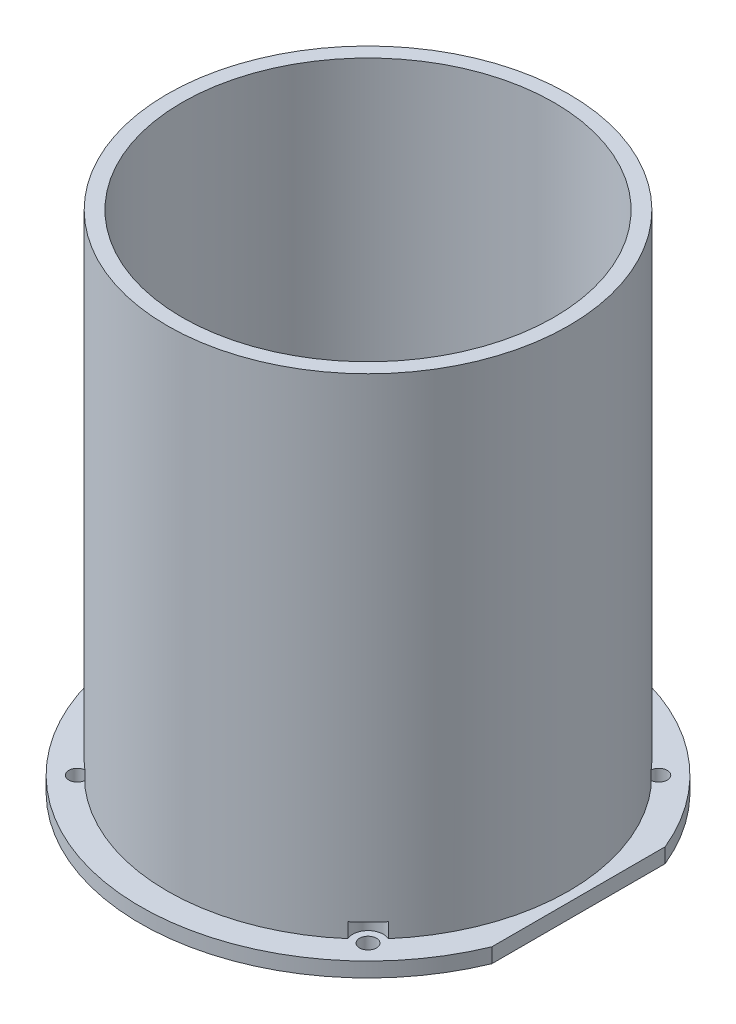
from build123d import *

# Parameters (mm, degrees)
SKETCH1_R                      = 46.5
SKETCH1_R_2                    = 38
BOSS_EXTRUDE1_DEPTH            = 3
SKETCH2_R                      = 41
SKETCH2_R_2                    = 38
BOSS_EXTRUDE2_DEPTH            = 100
SKETCH4_W                      = 1.7272
SKETCH4_H                      = 3
F_4_CLEARANCE_HOLE1_AT_2_COUNT = 2
F_4_CLEARANCE_HOLE1_AT_2_PITCH = 59.39696962
F_4_CLEARANCE_HOLE1_AT_3_COUNT = 2
F_4_CLEARANCE_HOLE1_AT_3_PITCH = 84
F_4_CLEARANCE_HOLE1_AT_4_COUNT = 2
F_4_CLEARANCE_HOLE1_AT_4_PITCH = 59.39696962
SKETCH5_R                      = 3.125
CUT_EXTRUDE1_DEPTH             = 3
BOSS_EXTRUDE3_START            = -2
BOSS_EXTRUDE3_DEPTH            = 7
CIRPATTERN3_COUNT              = 4
CUT_EXTRUDE2_DEPTH             = 120.685003238


with BuildPart() as part:
    # Sketch1 → Boss-Extrude1 (new body)
    with BuildSketch(Plane(origin=(0, 0, 0), x_dir=(1, 0, 0), z_dir=(0, 1, 0))):
        with Locations(Location((0, 0, 0), (0, 0, 270))):
            Circle(SKETCH1_R)
        with Locations(Location((0, 0, 0), (0, 0, 270))):
            Circle(SKETCH1_R_2, mode=Mode.SUBTRACT)
    extrude(amount=BOSS_EXTRUDE1_DEPTH)

    # Sketch2 → Boss-Extrude2 (add)
    with BuildSketch(Plane(origin=(0, 3, 0), x_dir=(1, 0, 0), z_dir=(0, 1, 0))):
        with Locations(Location((0, 0, 0), (0, 0, 270))):
            Circle(SKETCH2_R)
        with Locations(Location((0, 0, 0), (0, 0, 270))):
            Circle(SKETCH2_R_2, mode=Mode.SUBTRACT)
    extrude(amount=BOSS_EXTRUDE2_DEPTH)

    # Sketch4 → #4 Clearance Hole1 (revolve, cut)
    with BuildSketch(Plane(origin=(-29.69848481, 3, -29.69848481), x_dir=(0, 0, 1), z_dir=(1, 0, 0))):
        with Locations((0.8636, 1.5)):
            Rectangle(SKETCH4_W, SKETCH4_H)
    f_4_clearance_hole1 = revolve(axis=Axis((-29.69848481, 9.35, -29.69848481), (0, -1, 0)), mode=Mode.SUBTRACT)

    # #4 Clearance Hole1 at 2: #4 Clearance Hole1 ×2
    with Locations(*[(i * F_4_CLEARANCE_HOLE1_AT_2_PITCH, 0, 0) for i in range(1, F_4_CLEARANCE_HOLE1_AT_2_COUNT)]):
        add(f_4_clearance_hole1, mode=Mode.SUBTRACT)

    # #4 Clearance Hole1 at 3: #4 Clearance Hole1 ×2
    with Locations(*[Vector(0.7071067811865476, 0, 0.7071067811865476) * (i * F_4_CLEARANCE_HOLE1_AT_3_PITCH) for i in range(1, F_4_CLEARANCE_HOLE1_AT_3_COUNT)]):
        add(f_4_clearance_hole1, mode=Mode.SUBTRACT)

    # #4 Clearance Hole1 at 4: #4 Clearance Hole1 ×2
    with Locations(*[(0, 0, i * F_4_CLEARANCE_HOLE1_AT_4_PITCH) for i in range(1, F_4_CLEARANCE_HOLE1_AT_4_COUNT)]):
        add(f_4_clearance_hole1, mode=Mode.SUBTRACT)

    # Sketch5 → Cut-Extrude1 (cut)
    with BuildSketch(Plane(origin=(0, 3, 0), x_dir=(1, 0, 0), z_dir=(0, 1, 0))):
        with Locations((-29.69848481, 29.69848481)):
            Circle(SKETCH5_R)
    cut_extrude1 = extrude(amount=CUT_EXTRUDE1_DEPTH, mode=Mode.SUBTRACT)

    # Sketch6 → Boss-Extrude3 (add)
    with BuildSketch(Plane(origin=(0, 3, 0), x_dir=(1, 0, 0), z_dir=(0, 1, 0)).offset(BOSS_EXTRUDE3_START)):
        with BuildLine():
            ThreePointArc((-31.890308819, 25.76835663), (-26.516504294, 26.516504294), (-25.76835663, 31.890308819))
            ThreePointArc((-25.76835663, 31.890308819), (-26.313305576, 31.442168336), (-26.850462289, 30.984716795))
            ThreePointArc((-26.850462289, 30.984716795), (-27.488776119, 27.488776119), (-30.984716795, 26.850462289))
            ThreePointArc((-30.984716795, 26.850462289), (-31.442168336, 26.313305576), (-31.890308819, 25.76835663))
        make_face()
    boss_extrude3 = extrude(amount=BOSS_EXTRUDE3_DEPTH)

    # CirPattern3: Cut-Extrude1, Boss-Extrude3 ×4 about axis
    cirpattern3_axis = Axis((0, 0, 0), (0, 1, 0))
    add([cut_extrude1.rotate(cirpattern3_axis, i * 360 / CIRPATTERN3_COUNT) for i in range(1, CIRPATTERN3_COUNT)], mode=Mode.SUBTRACT)
    add([boss_extrude3.rotate(cirpattern3_axis, i * 360 / CIRPATTERN3_COUNT) for i in range(1, CIRPATTERN3_COUNT)])

    # Sketch7 → Cut-Extrude2 (cut, through all)
    with BuildSketch(Plane(origin=(0, 3, 0), x_dir=(1, 0, 0), z_dir=(0, 1, 0))):
        with BuildLine():
            Line((43, -17.69887002), (43, 17.69887002))
            ThreePointArc((43, 17.69887002), (46.5, 0), (43, -17.69887002))
        make_face()
    extrude(amount=-CUT_EXTRUDE2_DEPTH, mode=Mode.SUBTRACT)


solid = part.part
